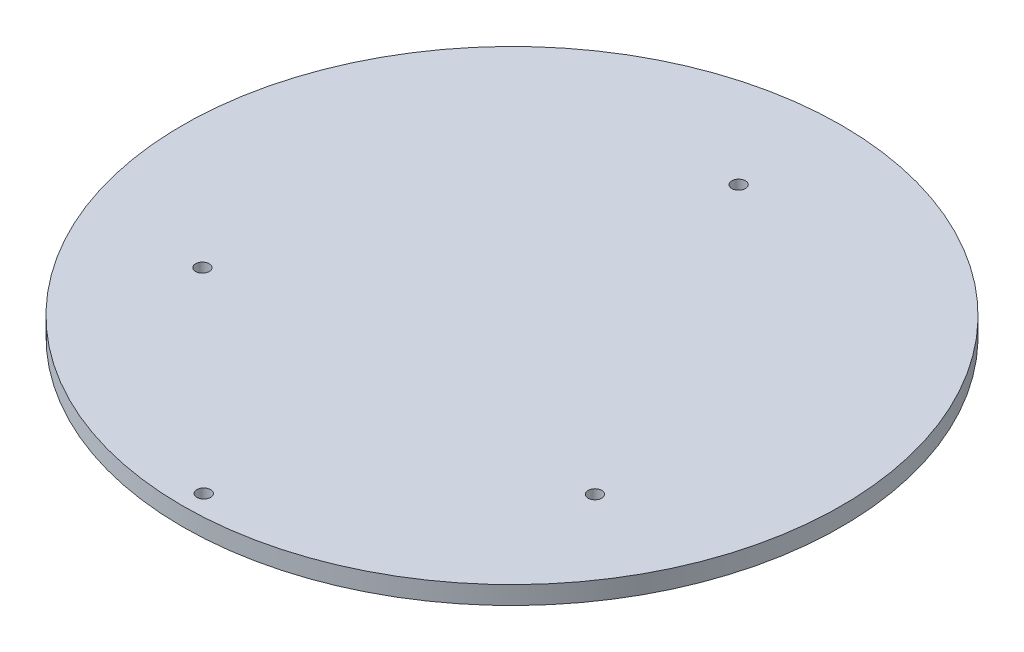
from build123d import *

# Parameters (mm, degrees)
SKETCH1_R           = 72.7
BOSS_EXTRUDE1_DEPTH = 4
SKETCH2_R           = 1.5
CUT_EXTRUDE1_DEPTH  = 103.891107487
CIRPATTERN1_COUNT   = 3
SKETCH3_R           = 1.5
CUT_EXTRUDE2_DEPTH  = 103.891107487


with BuildPart() as part:
    # Sketch1 → Boss-Extrude1 (new body)
    with BuildSketch(Plane(origin=(0, 0, 0), x_dir=(1, 0, 0), z_dir=(0, 1, 0))):
        Circle(SKETCH1_R)
    extrude(amount=BOSS_EXTRUDE1_DEPTH)

    # Sketch2 → Cut-Extrude1 (cut, through all)
    with BuildSketch(Plane(origin=(0, 4, 0), x_dir=(1, 0, 0), z_dir=(0, 1, 0))):
        with Locations((0, 50)):
            Circle(SKETCH2_R)
    cut_extrude1 = extrude(amount=-CUT_EXTRUDE1_DEPTH, mode=Mode.SUBTRACT)

    # CirPattern1: Cut-Extrude1 ×3 about axis
    cirpattern1_axis = Axis((0, 33.6, 0), (0, -1, 0))
    for i in range(1, CIRPATTERN1_COUNT):
        add(cut_extrude1.rotate(cirpattern1_axis, i * 360 / CIRPATTERN1_COUNT), mode=Mode.SUBTRACT)

    # Sketch3 → Cut-Extrude2 (cut, through all)
    with BuildSketch(Plane(origin=(0, 4, 0), x_dir=(1, 0, 0), z_dir=(0, 1, 0))):
        with Locations((0, -68)):
            Circle(SKETCH3_R)
    extrude(amount=-CUT_EXTRUDE2_DEPTH, mode=Mode.SUBTRACT)


solid = part.part
